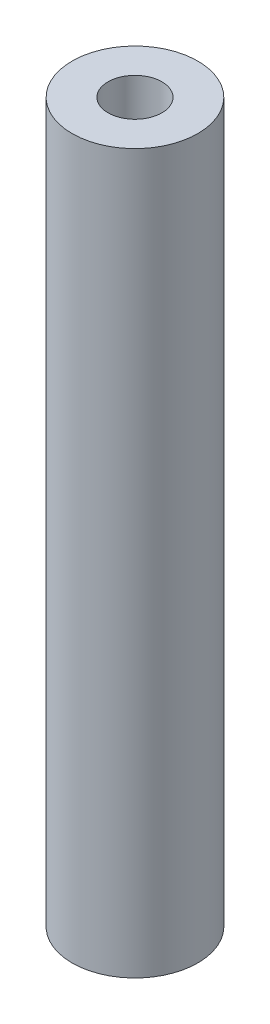
from build123d import *

# Parameters (mm, degrees)
CROQUIS1_R              = 3.5
CROQUIS1_R_2            = 1.5
SALIENTE_EXTRUIR1_DEPTH = 40


with BuildPart() as part:
    # Croquis1 → Saliente-Extruir1 (new body)
    with BuildSketch(Plane(origin=(0, 0, 0), x_dir=(1, 0, 0), z_dir=(0, 1, 0))):
        with Locations(Location((0, 0, 0), (0, 0, 270))):
            Circle(CROQUIS1_R)
        with Locations(Location((0, 0, 0), (0, 0, 270))):
            Circle(CROQUIS1_R_2, mode=Mode.SUBTRACT)
    extrude(amount=SALIENTE_EXTRUIR1_DEPTH)


solid = part.part
